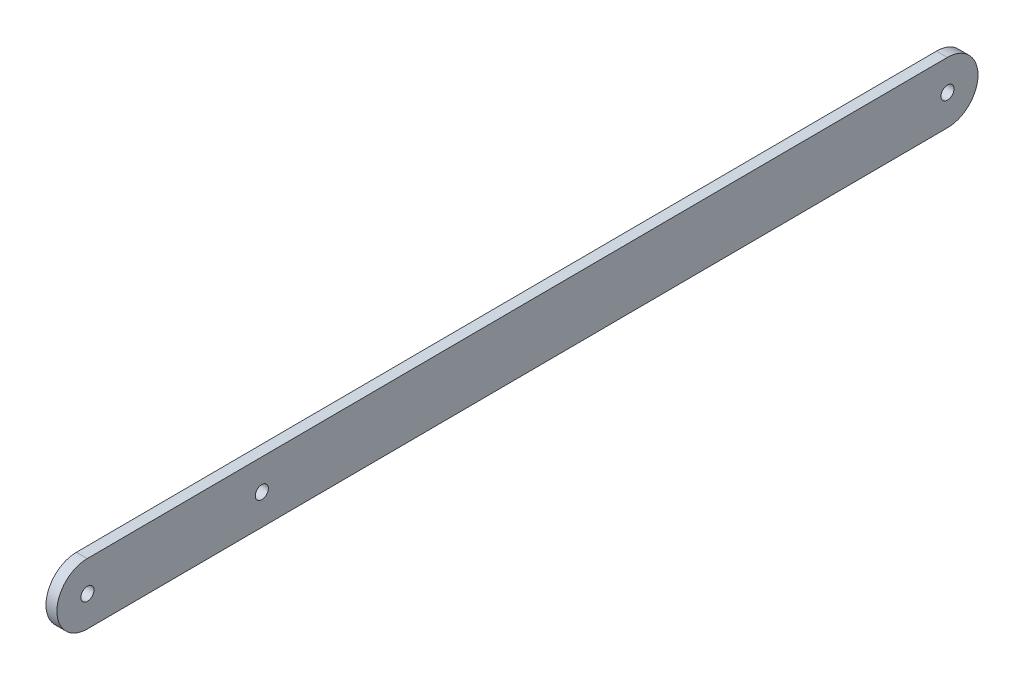
from build123d import *

# Parameters (mm, degrees)
SKETCH1_R           = 1.500000048
BOSS_EXTRUDE1_DEPTH = 2.5


with BuildPart() as part:
    # Sketch1 → Boss-Extrude1 (new body)
    with BuildSketch(Plane(origin=(0, 0, 0), x_dir=(0, 0, -1), z_dir=(1, 0, 0))):
        with BuildLine():
            Line((0.032394562, -6.086943939), (-197.247605438, -6.999925042))
            ThreePointArc((-197.247605438, -6.999925042), (-204.279925042, -0.032394562), (-197.312394562, 6.999925042))
            Line((-197.312394562, 6.999925042), (-0.032394562, 7.912906145))
            ThreePointArc((-0.032394562, 7.912906145), (6.999925042, 0.945375665), (0.032394562, -6.086943939))
        make_face()
        with Locations((-197.28, 0)):
            Circle(SKETCH1_R, mode=Mode.SUBTRACT)
        with Locations((0, 0.912981103)):
            Circle(SKETCH1_R, mode=Mode.SUBTRACT)
        with Locations((-157.28, 0.185113768)):
            Circle(SKETCH1_R, mode=Mode.SUBTRACT)
    extrude(amount=BOSS_EXTRUDE1_DEPTH)


solid = part.part
